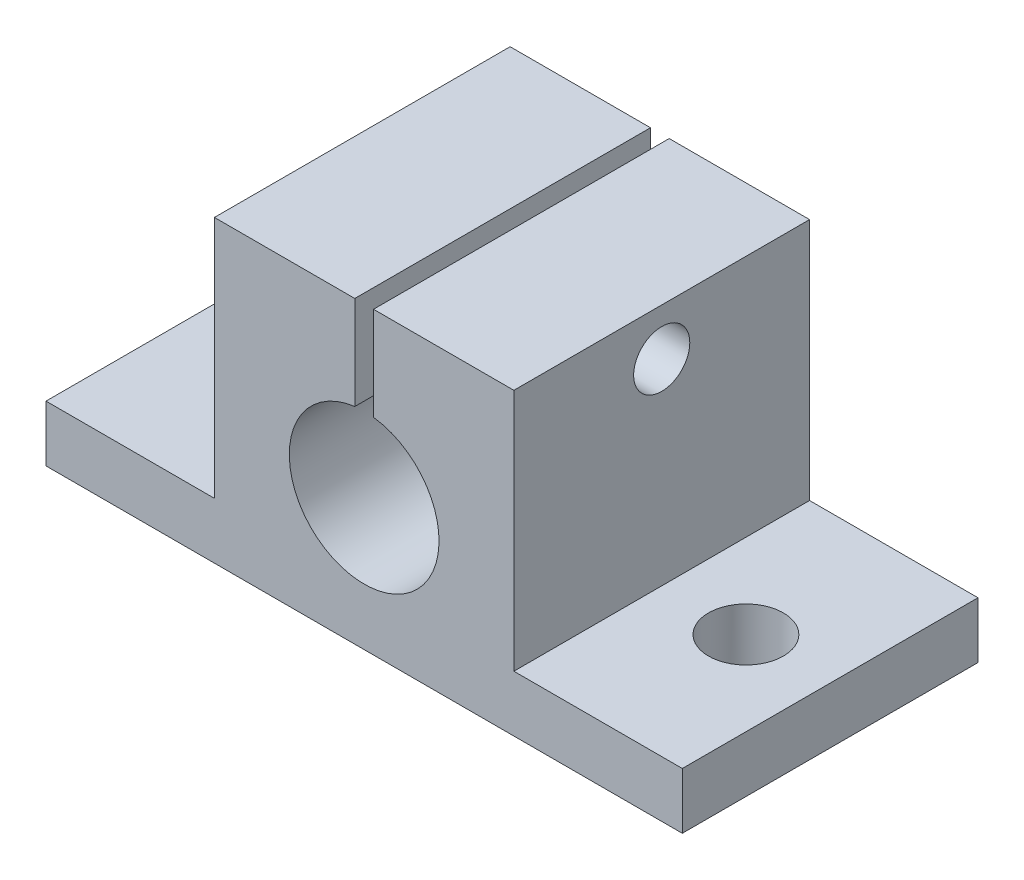
from build123d import *

# Parameters (mm, degrees)
BOSS_EXTRUDE1_DEPTH = 15.8
SKETCH2_R           = 2
CUT_EXTRUDE1_DEPTH  = 15.8
SKETCH4_R           = 2
CUT_EXTRUDE2_DEPTH  = 15.8
SKETCH5_R           = 1.5
CUT_EXTRUDE3_DEPTH  = 34.624990706


with BuildPart() as part:
    # Sketch1 → Boss-Extrude1 (new body)
    with BuildSketch(Plane.XY):
        with BuildLine():
            Line((0, 0), (34, 0))
            Line((34, 0), (34, 3))
            Line((34, 3), (25, 3))
            Line((25, 3), (25, 16))
            Line((25, 16), (17.5, 16))
            Line((17.5, 16), (17.5, 11))
            ThreePointArc((17.5, 11), (17, 3.031373033), (16.5, 11))
            Line((16.5, 11), (16.5, 16))
            Line((16.5, 16), (9, 16))
            Line((9, 16), (9, 3))
            Line((9, 3), (0, 3))
            Line((0, 3), (0, 0))
        make_face()
    extrude(amount=-BOSS_EXTRUDE1_DEPTH)

    # Sketch2 → Cut-Extrude1 (cut)
    with BuildSketch(Plane(origin=(0, 3, 0), x_dir=(1, 0, 0), z_dir=(0, 1, 0))):
        with Locations(Location((4.5, 7.9, 0), (0, 0, 270))):
            Circle(SKETCH2_R)
    extrude(amount=-CUT_EXTRUDE1_DEPTH, mode=Mode.SUBTRACT)

    # Sketch4 → Cut-Extrude2 (cut)
    with BuildSketch(Plane(origin=(0, 3, 0), x_dir=(1, 0, 0), z_dir=(0, 1, 0))):
        with Locations(Location((29.5, 7.9, 0), (0, 0, 270))):
            Circle(SKETCH4_R)
    extrude(amount=-CUT_EXTRUDE2_DEPTH, mode=Mode.SUBTRACT)

    # Sketch5 → Cut-Extrude3 (cut, through all)
    with BuildSketch(Plane(origin=(25, 0, 0), x_dir=(0, 0, -1), z_dir=(1, 0, 0))):
        with Locations((7.9, 13.5)):
            Circle(SKETCH5_R)
    extrude(amount=-CUT_EXTRUDE3_DEPTH, mode=Mode.SUBTRACT)


solid = part.part
